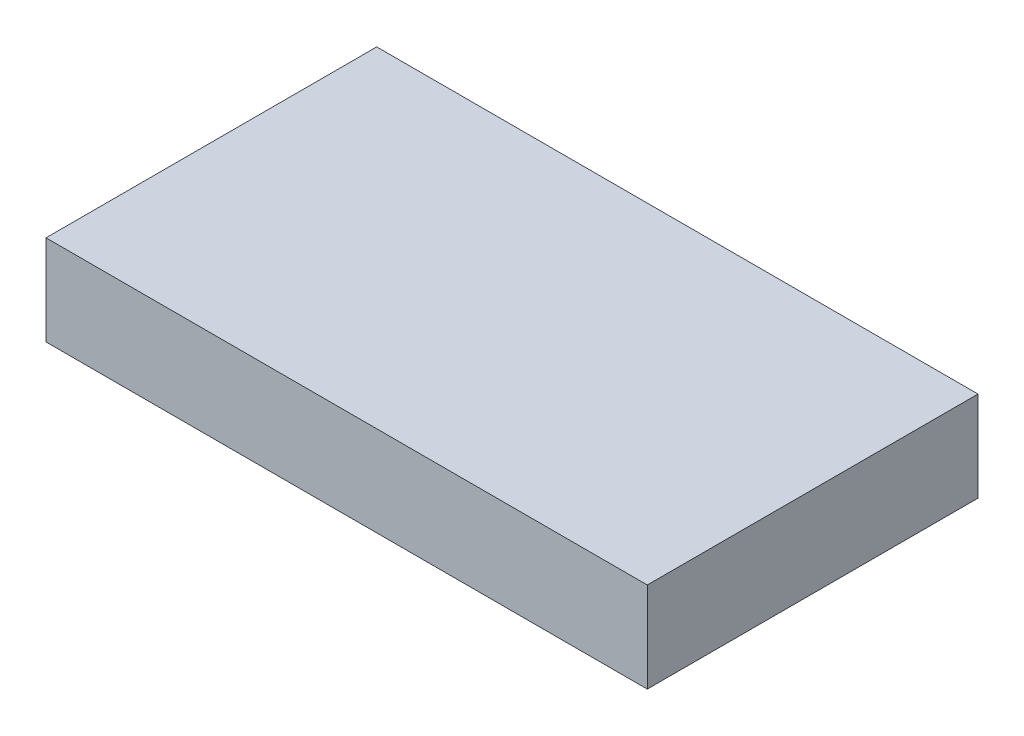
from build123d import *

# Parameters (mm, degrees)
BOSS_EXTRUDE1_DEPTH = 10
SKETCH2_W           = 100
SKETCH2_H           = 55
BOSS_EXTRUDE2_DEPTH = 5


with BuildPart() as part:
    # Sketch1 → Boss-Extrude1 (new body)
    with BuildSketch(Plane(origin=(0, 0, 0), x_dir=(1, 0, 0), z_dir=(0, 1, 0))):
        Polygon((0, 0), (0, 55), (9, 55), (9, 25), (91, 25), (91, 55), (100, 55), (100, 0), align=None)
    extrude(amount=BOSS_EXTRUDE1_DEPTH)

    # Sketch2 → Boss-Extrude2 (add)
    with BuildSketch(Plane(origin=(0, 10, 0), x_dir=(1, 0, 0), z_dir=(0, 1, 0))):
        with Locations((50, 27.5)):
            Rectangle(SKETCH2_W, SKETCH2_H)
    extrude(amount=BOSS_EXTRUDE2_DEPTH)


solid = part.part
